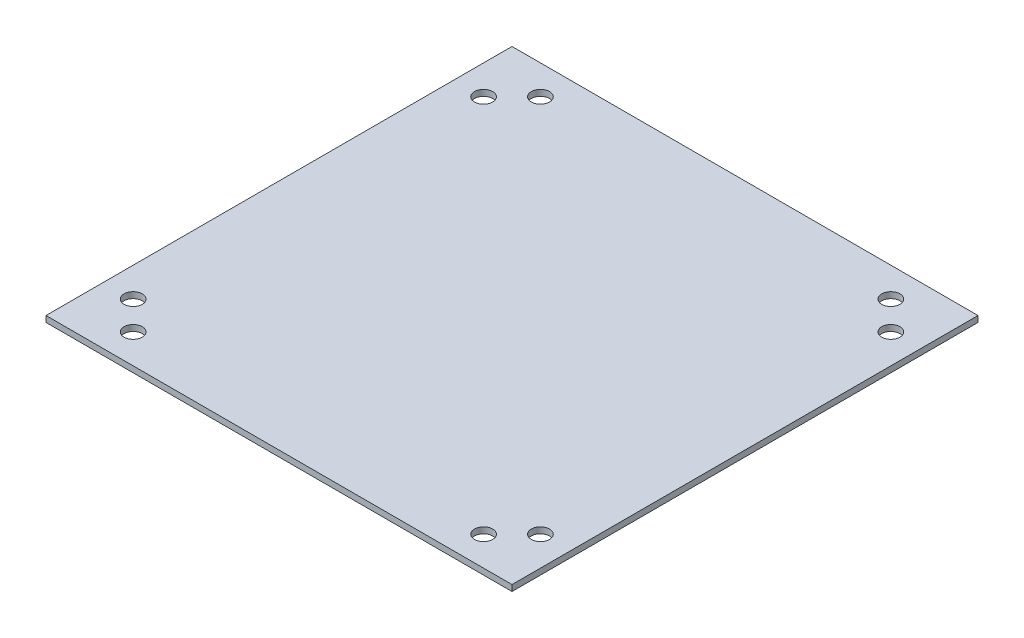
from build123d import *

# Parameters (mm, degrees)
BOSS_EXTRUDE1_DEPTH = 1.3
SKETCH3_W           = 100
SKETCH3_H           = 100
BOSS_EXTRUDE3_DEPTH = 1.3
SKETCH2_R           = 1.95
CUT_EXTRUDE1_DEPTH  = 1.3


with BuildPart() as part:
    # Sketch1 → Boss-Extrude1 (new body)
    with BuildSketch(Plane(origin=(0, 0, 0), x_dir=(1, 0, 0), z_dir=(0, 1, 0))):
        Polygon((7.2, 7.2), (7.2, 0), (90.2, 0), (90.2, 7.2), (97.4, 7.2), (97.4, 90.2), (90.2, 90.2), (90.2, 97.4), (7.2, 97.4), (7.2, 90.2), (0, 90.2), (0, 7.2), align=None)
    extrude(amount=BOSS_EXTRUDE1_DEPTH)

    # Sketch3 → Boss-Extrude3 (add)
    with BuildSketch(Plane(origin=(0, 1.3, 0), x_dir=(1, 0, 0), z_dir=(0, 1, 0))):
        with Locations((48.7, 48.7)):
            Rectangle(SKETCH3_W, SKETCH3_H)
    extrude(amount=-BOSS_EXTRUDE3_DEPTH)

    # Sketch2 → Cut-Extrude1 (cut)
    with BuildSketch(Plane.XZ):
        with Locations(Location((92.4, -86.3, 0), (0, 0, 270))):
            Circle(SKETCH2_R)
        with Locations(Location((86.3, -92.4, 0), (0, 0, 270))):
            Circle(SKETCH2_R)
        with Locations(Location((11.1, -92.4, 0), (0, 0, 270))):
            Circle(SKETCH2_R)
        with Locations(Location((5, -86.3, 0), (0, 0, 270))):
            Circle(SKETCH2_R)
        with Locations(Location((5, -11.1, 0), (0, 0, 270))):
            Circle(SKETCH2_R)
        with Locations(Location((11.1, -5, 0), (0, 0, 270))):
            Circle(SKETCH2_R)
        with Locations(Location((86.3, -5, 0), (0, 0, 270))):
            Circle(SKETCH2_R)
        with Locations(Location((92.4, -11.1, 0), (0, 0, 270))):
            Circle(SKETCH2_R)
    extrude(amount=-CUT_EXTRUDE1_DEPTH, mode=Mode.SUBTRACT)


solid = part.part
